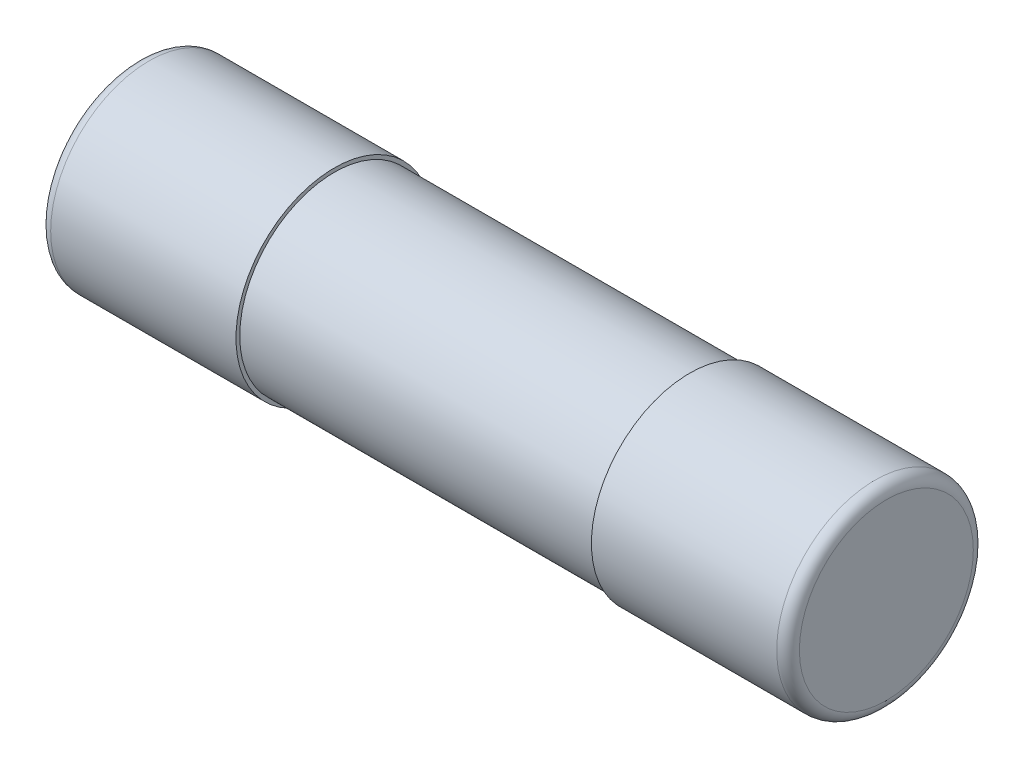
from build123d import *

# Parameters (mm, degrees)
ESQUISSE1_R           = 2.5
BOSS_EXTRU_1_DEPTH    = 4.7
ESQUISSE2_R           = 2.6
BOSS_EXTRU_2_DEPTH    = 5.2
CONG_1_R              = 0.3
CONG_1_OF_SYM_TRIE1_R = 0.3


with BuildPart() as part:
    # Esquisse1 → Boss.-Extru.1 (new, symmetric)
    with BuildSketch(Plane(origin=(0, 0, 0), x_dir=(0, 0, -1), z_dir=(1, 0, 0))):
        Circle(ESQUISSE1_R)
    extrude(amount=BOSS_EXTRU_1_DEPTH, both=True)

    # Esquisse2 → Boss.-Extru.2 (add)
    with BuildSketch(Plane(origin=(4.7, 0, 0), x_dir=(0, 0, -1), z_dir=(1, 0, 0))):
        Circle(ESQUISSE2_R)
    boss_extru_2 = extrude(amount=BOSS_EXTRU_2_DEPTH)

    # Congé1
    cong_1_edges = [part.edges().sort_by_distance(p)[0] for p in [
        (9.9, 0, 2.6),
    ]]
    fillet(cong_1_edges, radius=CONG_1_R)

    # Symétrie1: Boss.-Extru.2 across plane
    add(boss_extru_2.mirror(Plane(origin=(0, 0, 0), x_dir=(0, 0, 1), z_dir=(1, 0, 0))))

    # Congé1 of Symétrie1
    cong_1_of_sym_trie1_edges = [part.edges().sort_by_distance(p)[0] for p in [
        (-9.9, 0, 2.6),
    ]]
    fillet(cong_1_of_sym_trie1_edges, radius=CONG_1_OF_SYM_TRIE1_R)


solid = part.part
